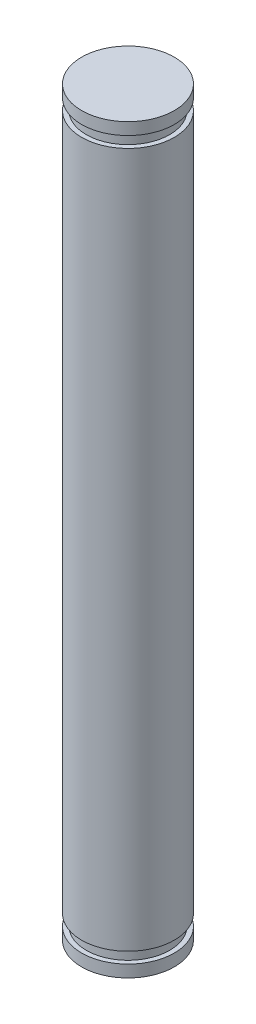
from build123d import *


with BuildPart() as part:
    # 草图1 → 旋转1 (revolve)
    with BuildSketch(Plane.XY, mode=Mode.PRIVATE) as revolve_1_sk:
        Polygon((0, 0), (-5, 0), (-5, 1.3), (-4.5, 1.3), (-4.5, 2.5), (-5, 2.5), (-5, 77.5), (-4.5, 77.5), (-4.5, 78.7), (-5, 78.7), (-5, 80), (0, 80), align=None)
    revolve(revolve_1_sk.sketch.rotate(Axis((0, 80, 0), (0, -1, 0)), 270), axis=Axis((0, 80, 0), (0, -1, 0)))


solid = part.part
